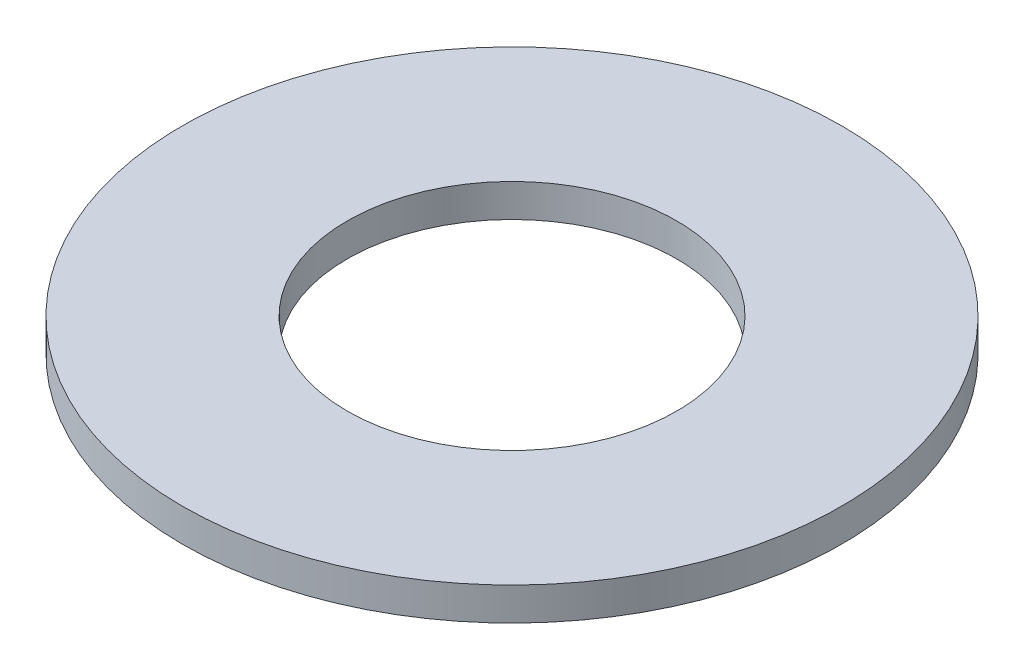
from build123d import *

# Parameters (mm, degrees)
SKETCH1_R           = 10
SKETCH1_R_2         = 5
BOSS_EXTRUDE1_DEPTH = 1


with BuildPart() as part:
    # Sketch1 → Boss-Extrude1 (new body)
    with BuildSketch(Plane(origin=(0, 0, 0), x_dir=(1, 0, 0), z_dir=(0, 1, 0))):
        with Locations(Location((0, 0, 0), (0, 0, 270))):
            Circle(SKETCH1_R)
        with Locations(Location((0, 0, 0), (0, 0, 270))):
            Circle(SKETCH1_R_2, mode=Mode.SUBTRACT)
    extrude(amount=BOSS_EXTRUDE1_DEPTH)


solid = part.part
